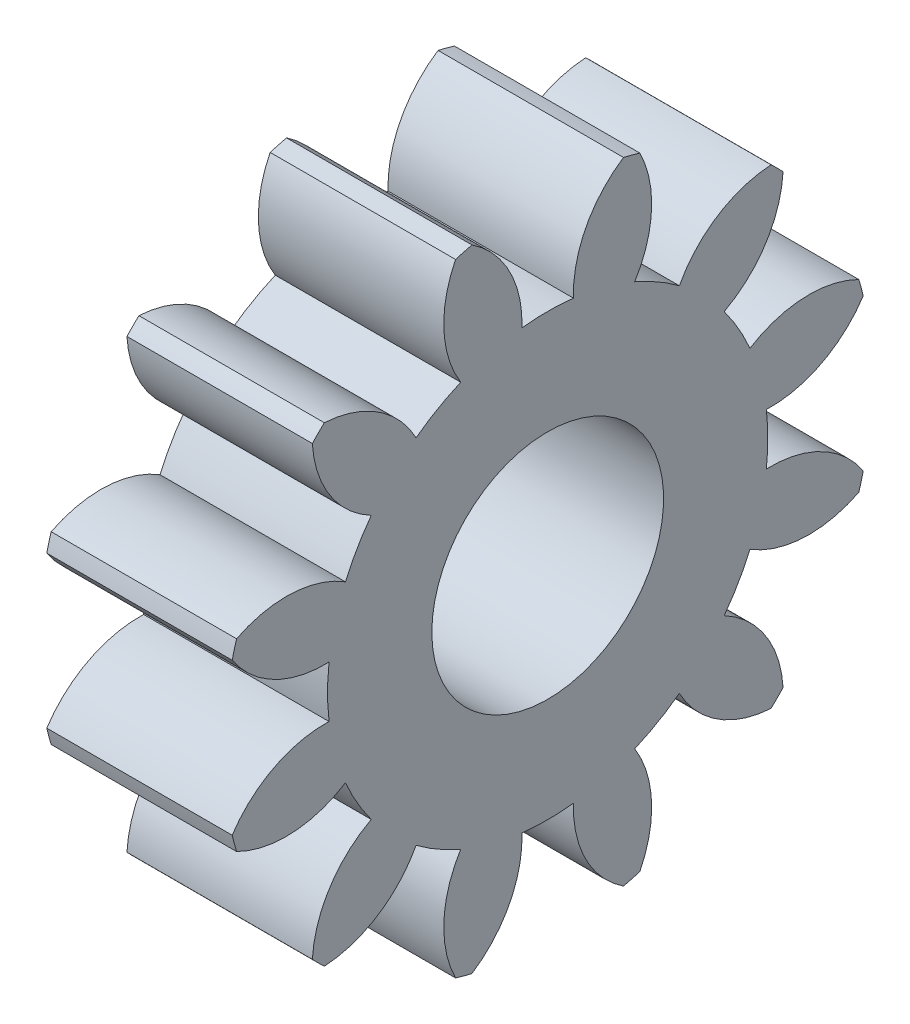
from build123d import *

# Parameters (mm, degrees)
BASPROSKE_W     = 8
BASPROSKE_H     = 14
TOOTHCUT_DEPTH  = 22.354156504
TEETHCUTS_COUNT = 12
TEETHCUTS_ANGLE = 330
BORSKE_R        = 5
BORE_DEPTH      = 50.0000508


with BuildPart() as part:
    # BasProSke → Base-Revolve (revolve)
    with BuildSketch(Plane(origin=(0, 0, 0), x_dir=(1, 0, 0), z_dir=(0, 1, 0)), mode=Mode.PRIVATE) as base_revolve_sk:
        with Locations((4, 7)):
            Rectangle(BASPROSKE_W, BASPROSKE_H)
    revolve(base_revolve_sk.sketch.rotate(Axis((-10, 0, 0), (1, 0, 0)), 180), axis=Axis((-10, 0, 0), (1, 0, 0)))

    # TooCutSke → ToothCut (cut, through all)
    with BuildSketch(Plane(origin=(0, 0, 0), x_dir=(0, 0, -1), z_dir=(1, 0, 0))):
        with BuildLine():
            ThreePointArc((1.111908866, 9.433698091), (0, 9.499), (-1.111908866, 9.433698091))
            ThreePointArc((-1.111908866, 9.433698091), (-1.651516138, 11.821129337), (-3.298149691, 13.632096456))
            ThreePointArc((-3.298149691, 13.632096456), (0, 14.0254), (3.298149691, 13.632096456))
            ThreePointArc((3.298149691, 13.632096456), (1.651516138, 11.821129337), (1.111908866, 9.433698091))
        make_face()
    toothcut = extrude(amount=TOOTHCUT_DEPTH, mode=Mode.SUBTRACT)

    # TeethCuts: ToothCut ×12 about axis
    teethcuts_axis = Axis((-10, 0, 0), (1, 0, 0))
    for i in range(1, TEETHCUTS_COUNT):
        add(toothcut.rotate(teethcuts_axis, i * TEETHCUTS_ANGLE / (TEETHCUTS_COUNT - 1)), mode=Mode.SUBTRACT)

    # BorSke → Bore (cut, symmetric)
    with BuildSketch(Plane(origin=(0, 0, 0), x_dir=(0, 0, -1), z_dir=(1, 0, 0))):
        with Locations(Location((0, 0, 0), (0, 0, 180))):
            Circle(BORSKE_R)
    extrude(amount=BORE_DEPTH, both=True, mode=Mode.SUBTRACT)


solid = part.part
